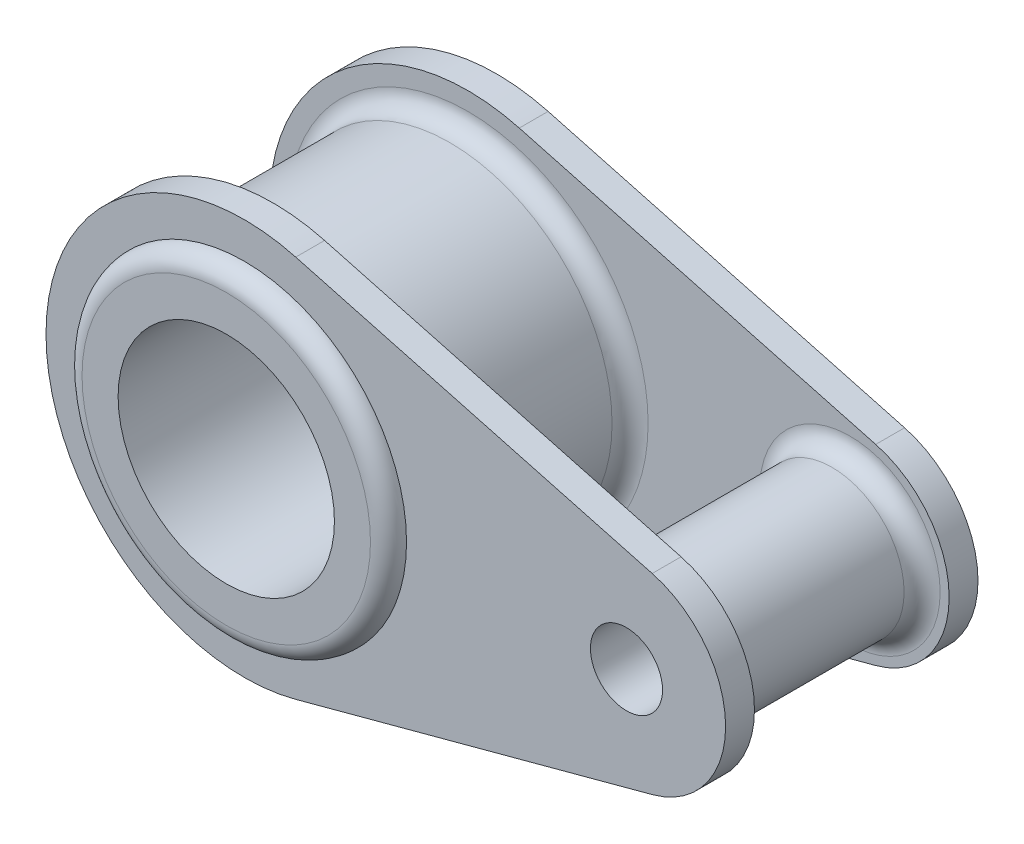
from build123d import *

# Parameters (mm, degrees)
SKETCH_1_R               = 45
SKETCH_1_R_2             = 30
EXTRUDE_1_DEPTH          = 80
FILLET_1_R               = 5
EXTRUDE_START            = 5
SKETCH_1_6_R             = 10
SKETCH_1_6_R_2           = 45
EXTRUDE_4_DEPTH          = 8
EXTRUDE_START_2          = -13
SKETCH_3_R               = 10
SKETCH_3_R_2             = 30
EXTRUDE_7_DEPTH          = 8
SKETCH_4_R               = 20
EXTRUDE_9_DEPTH          = 70
CUT_EXTRUDE_1_DEPTH      = 163.702950188
CUT_EXTRUDE_1_DEPTH_BACK = 163.702950188
SKETCH_5_R               = 10
FILLET_2_R               = 5


with BuildPart() as part:
    # 草图1 → 凸台-拉伸1 (new body)
    with BuildSketch(Plane.XY):
        Circle(SKETCH_1_R)
        Circle(SKETCH_1_R_2, mode=Mode.SUBTRACT)
    extrude(amount=EXTRUDE_1_DEPTH)

    # 圆角1
    fillet_1_edges = [part.edges().sort_by_distance(p)[0] for p in [
        (-45, 0, 0),
        (-45, 0, 80),
    ]]
    fillet(fillet_1_edges, radius=FILLET_1_R)

    # 草图1<6> → 凸台-拉伸4 (add)
    with BuildSketch(Plane.XY.offset(EXTRUDE_START)):
        with BuildLine():
            Line((113.134433962, 26.558423373), (14.268867925, 53.116846745))
            ThreePointArc((14.268867925, 53.116846745), (-55, 0), (14.268867925, -53.116846745))
            Line((14.268867925, -53.116846745), (113.134433962, -26.558423373))
            ThreePointArc((113.134433962, -26.558423373), (133.5, 0), (113.134433962, 26.558423373))
        make_face()
        with Locations((106, 0)):
            Circle(SKETCH_1_6_R, mode=Mode.SUBTRACT)
        Circle(SKETCH_1_6_R_2, mode=Mode.SUBTRACT)
    extrude(amount=EXTRUDE_4_DEPTH)

    # 草图3 → 凸台-拉伸7 (add)
    with BuildSketch(Plane.XY.offset(80).offset(EXTRUDE_START_2)):
        with BuildLine():
            Line((14.268867925, -53.116846745), (113.134433962, -26.558423373))
            ThreePointArc((113.134433962, -26.558423373), (133.5, 0), (113.134433962, 26.558423373))
            Line((113.134433962, 26.558423373), (14.268867925, 53.116846745))
            ThreePointArc((14.268867925, 53.116846745), (-55, 0), (14.268867925, -53.116846745))
        make_face()
        with Locations((106, 0)):
            Circle(SKETCH_3_R, mode=Mode.SUBTRACT)
        Circle(SKETCH_3_R_2, mode=Mode.SUBTRACT)
    extrude(amount=EXTRUDE_7_DEPTH)

    # 草图4 → 凸台-拉伸9 (add)
    with BuildSketch(Plane(origin=(0, 0, 5), x_dir=(-1, 0, 0), z_dir=(0, 0, -1))):
        with Locations((-106, 0)):
            Circle(SKETCH_4_R)
    extrude(amount=-EXTRUDE_9_DEPTH)

    # 草图5 → 切除-拉伸1 (cut, two sides: drawn at the far end of the back side and taken through both)
    with BuildSketch(Plane(origin=(0, 0, 5), x_dir=(-1, 0, 0), z_dir=(0, 0, -1)).offset(-CUT_EXTRUDE_1_DEPTH_BACK)):
        with Locations((-106, 0)):
            Circle(SKETCH_5_R)
    extrude(amount=CUT_EXTRUDE_1_DEPTH + CUT_EXTRUDE_1_DEPTH_BACK, mode=Mode.SUBTRACT)

    # 圆角2
    fillet_2_edges = [part.edges().sort_by_distance(p)[0] for p in [
        (-45, 0, 13),
        (-45, 0, 67),
        (126, 0, 13),
        (126, 0, 67),
    ]]
    fillet(fillet_2_edges, radius=FILLET_2_R)


solid = part.part
